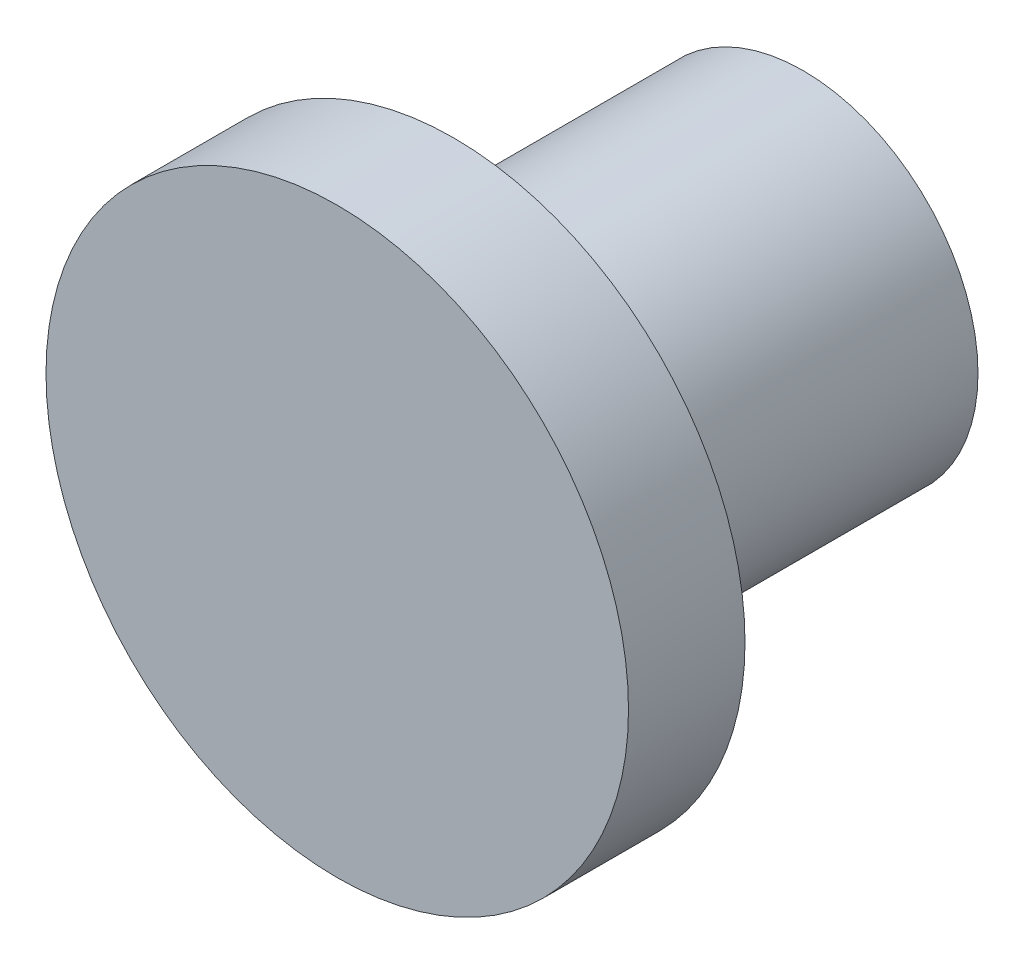
from build123d import *

# Parameters (mm, degrees)
SKETCH1_R           = 1.5
BOSS_EXTRUDE1_DEPTH = 3
SKETCH2_R           = 2.5
BOSS_EXTRUDE2_DEPTH = 1


with BuildPart() as part:
    # Sketch1 → Boss-Extrude1 (new body)
    with BuildSketch(Plane.XY):
        Circle(SKETCH1_R)
    extrude(amount=BOSS_EXTRUDE1_DEPTH)

    # Sketch2 → Boss-Extrude2 (add)
    with BuildSketch(Plane.XY.offset(3)):
        Circle(SKETCH2_R)
    extrude(amount=BOSS_EXTRUDE2_DEPTH)


solid = part.part
